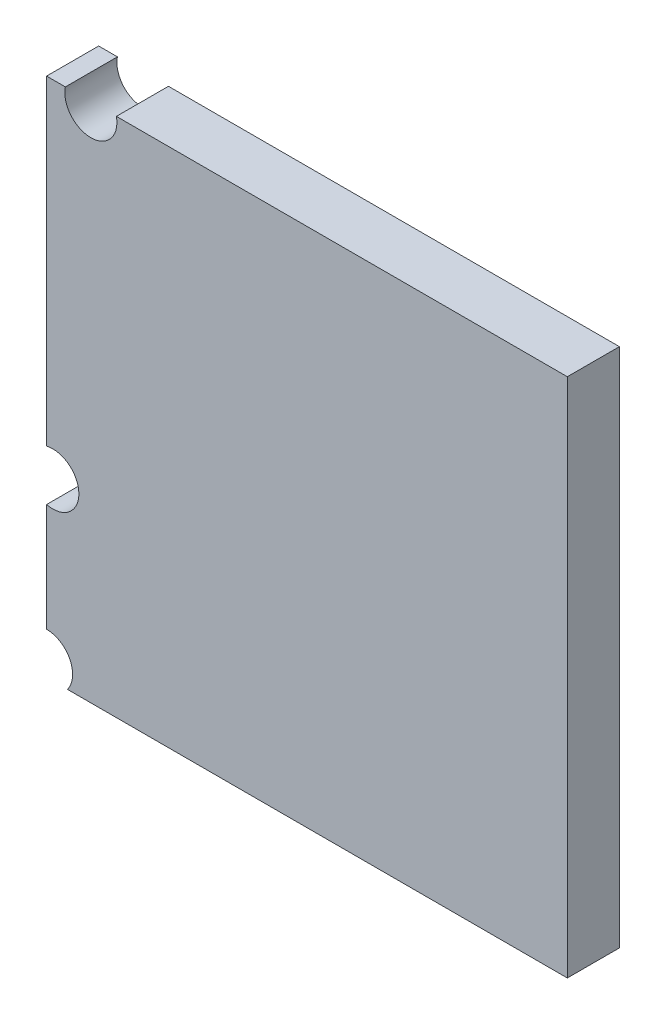
from build123d import *

# Parameters (mm, degrees)
SKETCH_1_W          = 100
SKETCH_1_H          = 100
EXTRUDE_1_DEPTH     = 10
SKETCH_2_R          = 5
CUT_EXTRUDE_1_DEPTH = 10
SKETCH_3_R          = 5
CUT_EXTRUDE_2_DEPTH = 10
SKETCH_4_R          = 5
CUT_EXTRUDE_3_DEPTH = 10


with BuildPart() as part:
    # Эскиз1 → Бобышка-Вытянуть1 (new body)
    with BuildSketch(Plane.XY):
        with Locations((50, 50)):
            Rectangle(SKETCH_1_W, SKETCH_1_H)
    extrude(amount=EXTRUDE_1_DEPTH)

    # Эскиз2 → Вырез-Вытянуть1 (cut)
    with BuildSketch(Plane.XY):
        with Locations((0, 3)):
            Circle(SKETCH_2_R)
    extrude(amount=CUT_EXTRUDE_1_DEPTH, mode=Mode.SUBTRACT)

    # Эскиз3 → Вырез-Вытянуть2 (cut)
    with BuildSketch(Plane.XY):
        with Locations((1.2, 33.6)):
            Circle(SKETCH_3_R)
    extrude(amount=CUT_EXTRUDE_2_DEPTH, mode=Mode.SUBTRACT)

    # Эскиз4 → Вырез-Вытянуть3 (cut)
    with BuildSketch(Plane.XY):
        with Locations((8.5, 99)):
            Circle(SKETCH_4_R)
    extrude(amount=CUT_EXTRUDE_3_DEPTH, mode=Mode.SUBTRACT)


solid = part.part
